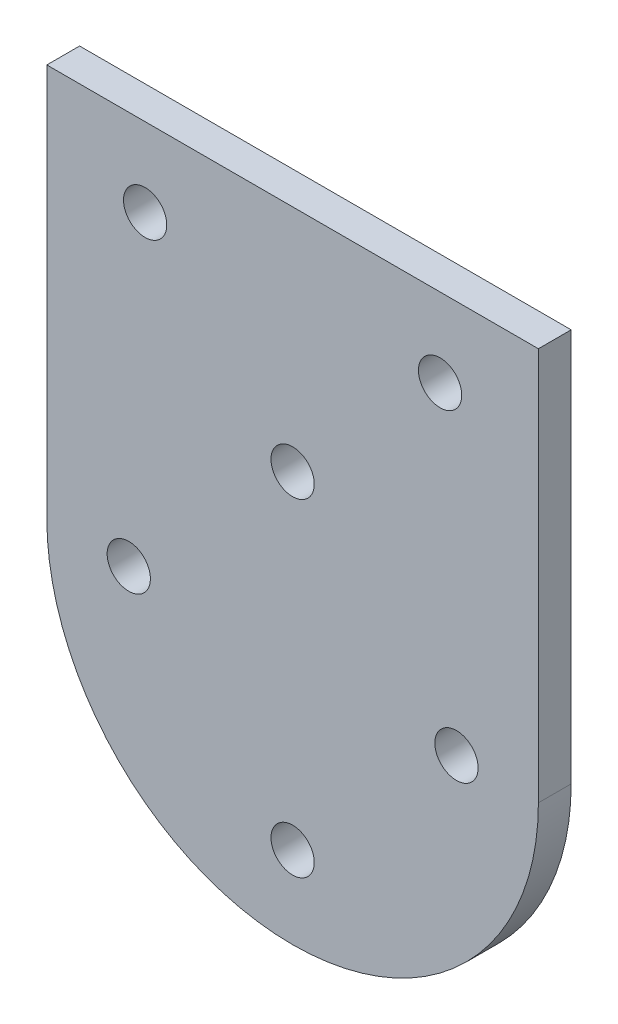
from build123d import *

# Parameters (mm, degrees)
BOSS_EXTRUDE1_DEPTH            = 5
M6_CLEARANCE_HOLE2_D           = 6.6
M6_CLEARANCE_HOLE2_CSINK_D     = 6.65
M6_CLEARANCE_HOLE2_CSINK_ANGLE = 90


with BuildPart() as part:
    # Sketch6 → Boss-Extrude1 (new body)
    with BuildSketch(Plane.XY):
        with BuildLine():
            Line((37.5, 0), (37.5, 60))
            Line((37.5, 60), (-37.5, 60))
            Line((-37.5, 60), (-37.5, 0))
            ThreePointArc((-37.5, 0), (0, -37.5), (37.5, 0))
        make_face()
    extrude(amount=BOSS_EXTRUDE1_DEPTH)

    # M6 Clearance Hole2 (through all)
    with Locations(Plane(origin=(0, 0, 0), x_dir=(-1, 0, 0), z_dir=(0, 0, -1))):
        with Locations((-22.5, 48), (22.5, 48), (0, 25), (25, 0), (0, -25), (-25, 0)):
            CounterSinkHole(M6_CLEARANCE_HOLE2_D / 2, M6_CLEARANCE_HOLE2_CSINK_D / 2, counter_sink_angle=M6_CLEARANCE_HOLE2_CSINK_ANGLE)


solid = part.part
